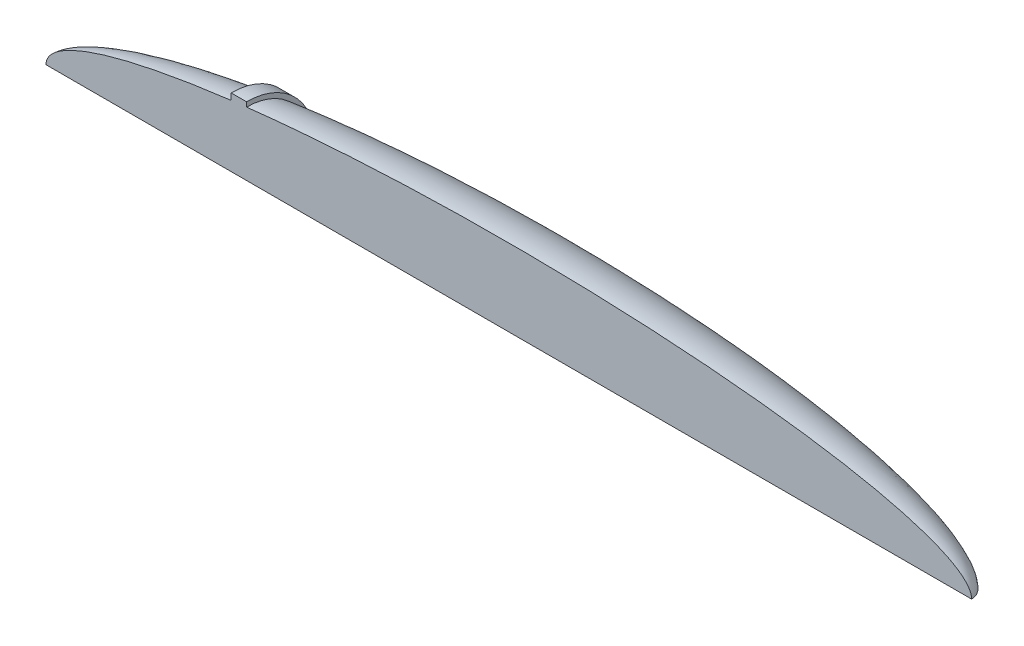
from build123d import *

# Parameters (mm, degrees)
REVOLVE1_ANGLE = 90


with BuildPart() as part:
    # Sketch1 → Revolve1 (revolve)
    with BuildSketch(Plane(origin=(0, 0, 0), x_dir=(1, 0, 0), z_dir=(0, 1, 0))):
        with BuildLine():
            Line((-6000, 0), (6000, 0))
            add(Edge.make_bspline(
                [(6000, 0), (6000, 1901.416476047), (-3400, 823.947139621)],
                knots=[0, 0, 0, 2.17325096, 2.17325096, 2.17325096], degree=2, weights=[1, 0.465474668, 1]))
            Line((-3400, 823.947139621), (-3400, 883.947139621))
            Line((-3400, 883.947139621), (-3600, 883.947139621))
            Line((-3600, 883.947139621), (-3600, 800))
            add(Edge.make_bspline(
                [(-3600, 800), (-6000, 500), (-6000, 0)],
                knots=[2.214297436, 2.214297436, 2.214297436, 3.141592654, 3.141592654, 3.141592654], degree=2, weights=[1, 0.894427191, 1]))
        make_face()
    revolve(axis=Axis((-1000, 0, 0), (1, 0, 0)), revolution_arc=REVOLVE1_ANGLE)


solid = part.part
